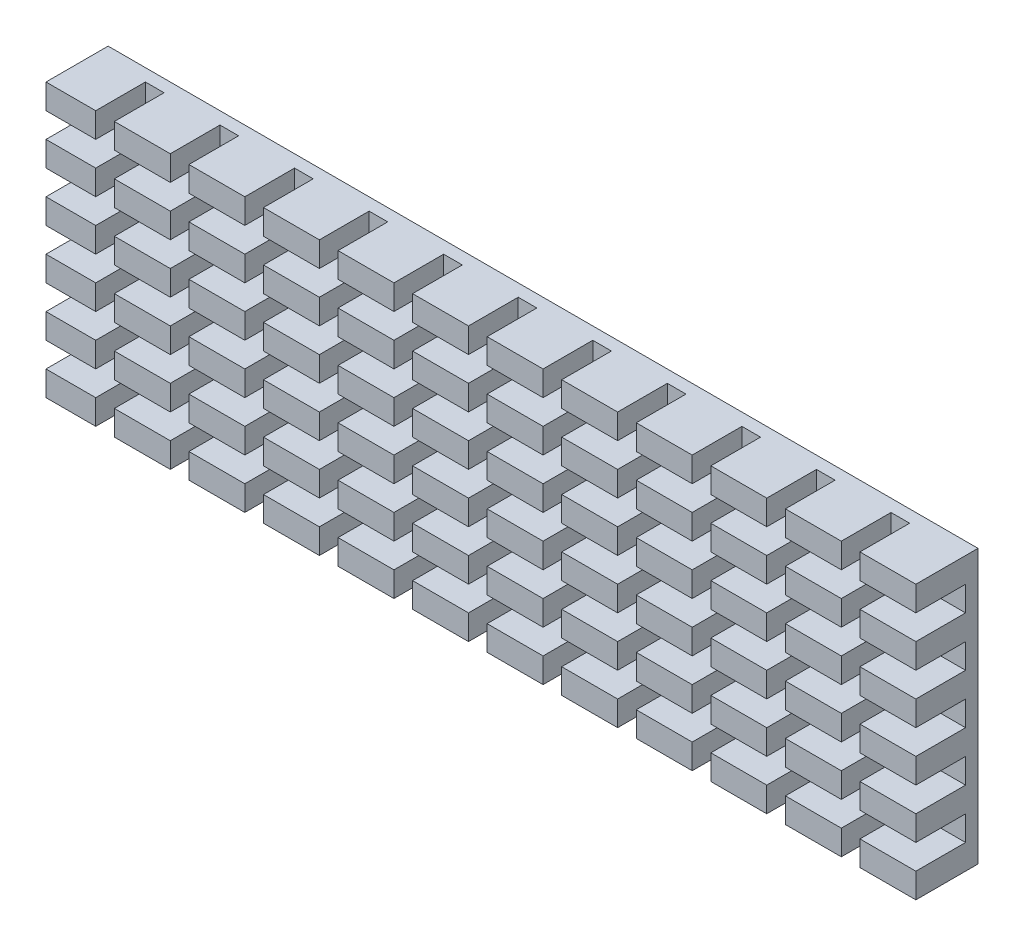
from build123d import *

# Parameters (mm, degrees)
SKETCH1_W            = 70
SKETCH1_H            = 22
BOSS_EXTRUDE1_DEPTH  = 5
CUT_EXTRUDE1_START   = 1
SKETCH3_W            = 70
SKETCH3_H            = 2
CUT_EXTRUDE1_DEPTH   = 37.027017163
LPATTERN1_COUNT      = 4
LPATTERN1_PITCH      = 4
LPATTERN1_COUNT_DIR2 = 4
LPATTERN1_PITCH_DIR2 = 4
CUT_EXTRUDE2_START   = 1
SKETCH4_W            = 1.5
SKETCH4_H            = 22
CUT_EXTRUDE2_DEPTH   = 37.027017163
LPATTERN2_COUNT      = 12
LPATTERN2_PITCH      = 6


with BuildPart() as part:
    # Sketch1 → Boss-Extrude1 (new body)
    with BuildSketch(Plane.XY):
        Rectangle(SKETCH1_W, SKETCH1_H)
    extrude(amount=BOSS_EXTRUDE1_DEPTH)

    # Sketch3 → Cut-Extrude1 (cut, through all)
    with BuildSketch(Plane.XY.offset(CUT_EXTRUDE1_START)):
        Rectangle(SKETCH3_W, SKETCH3_H)
    cut_extrude1 = extrude(amount=CUT_EXTRUDE1_DEPTH, mode=Mode.SUBTRACT)

    # LPattern1: Cut-Extrude1 4 × 4
    with Locations(*[Vector(0, 1, 0) * (i * LPATTERN1_PITCH) + Vector(0, -1, 0) * (j * LPATTERN1_PITCH_DIR2) for i in range(LPATTERN1_COUNT) for j in range(LPATTERN1_COUNT_DIR2) if (i, j) != (0, 0)]):
        add(cut_extrude1, mode=Mode.SUBTRACT)

    # Sketch4 → Cut-Extrude2 (cut, through all)
    with BuildSketch(Plane.XY.offset(CUT_EXTRUDE2_START)):
        with Locations((-30.25, 0)):
            Rectangle(SKETCH4_W, SKETCH4_H)
    cut_extrude2 = extrude(amount=CUT_EXTRUDE2_DEPTH, mode=Mode.SUBTRACT)

    # LPattern2: Cut-Extrude2 ×12
    with Locations(*[(i * LPATTERN2_PITCH, 0, 0) for i in range(1, LPATTERN2_COUNT)]):
        add(cut_extrude2, mode=Mode.SUBTRACT)


solid = part.part
